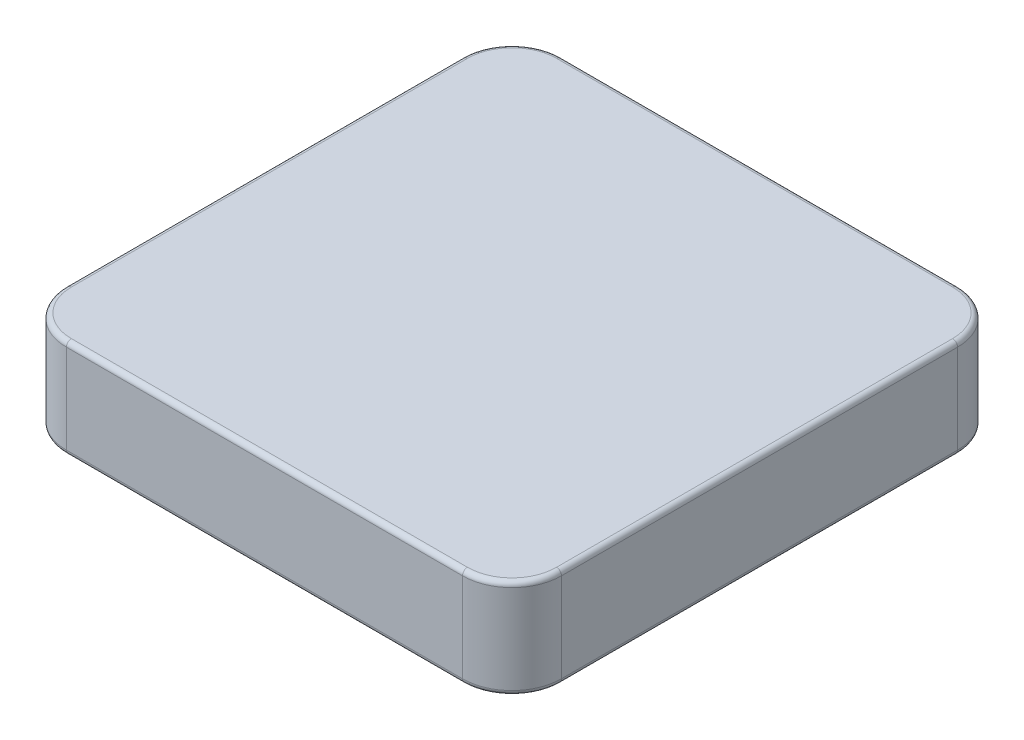
from build123d import *

# Parameters (mm, degrees)
BOSS_EXTRUDE1_DEPTH = 10
FILLET1_R           = 1
FILLET2_R           = 1


with BuildPart() as part:
    # Sketch1 → Boss-Extrude1 (new, symmetric)
    with BuildSketch(Plane(origin=(0, 0, 0), x_dir=(1, 0, 0), z_dir=(0, 1, 0))):
        with BuildLine():
            Line((10, 0), (90, 0))
            ThreePointArc((90, 0), (97.071067812, -2.928932188), (100, -10))
            Line((100, -10), (100, -90))
            ThreePointArc((100, -90), (97.071067812, -97.071067812), (90, -100))
            Line((90, -100), (10, -100))
            ThreePointArc((10, -100), (2.928932188, -97.071067812), (0, -90))
            Line((0, -90), (0, -10))
            ThreePointArc((0, -10), (2.928932188, -2.928932188), (10, 0))
        make_face()
    extrude(amount=BOSS_EXTRUDE1_DEPTH, both=True)

    # Fillet1
    fillet1_edges = [part.edges().sort_by_distance(p)[0] for p in [
        (100, -10, 50),
        (97.071067812, -10, 97.071067812),
        (50, -10, 100),
        (2.928932188, -10, 97.071067812),
        (0, -10, 50),
        (2.928932188, -10, 2.928932188),
        (50, -10, 0),
        (97.071067812, -10, 2.928932188),
    ]]
    fillet(fillet1_edges, radius=FILLET1_R)

    # Fillet2
    fillet2_edges = [part.edges().sort_by_distance(p)[0] for p in [
        (97.071067812, 10, 97.071067812),
        (100, 10, 50),
        (97.071067812, 10, 2.928932188),
        (50, 10, 0),
        (2.928932188, 10, 2.928932188),
        (0, 10, 50),
        (2.928932188, 10, 97.071067812),
        (50, 10, 100),
    ]]
    fillet(fillet2_edges, radius=FILLET2_R)


solid = part.part
